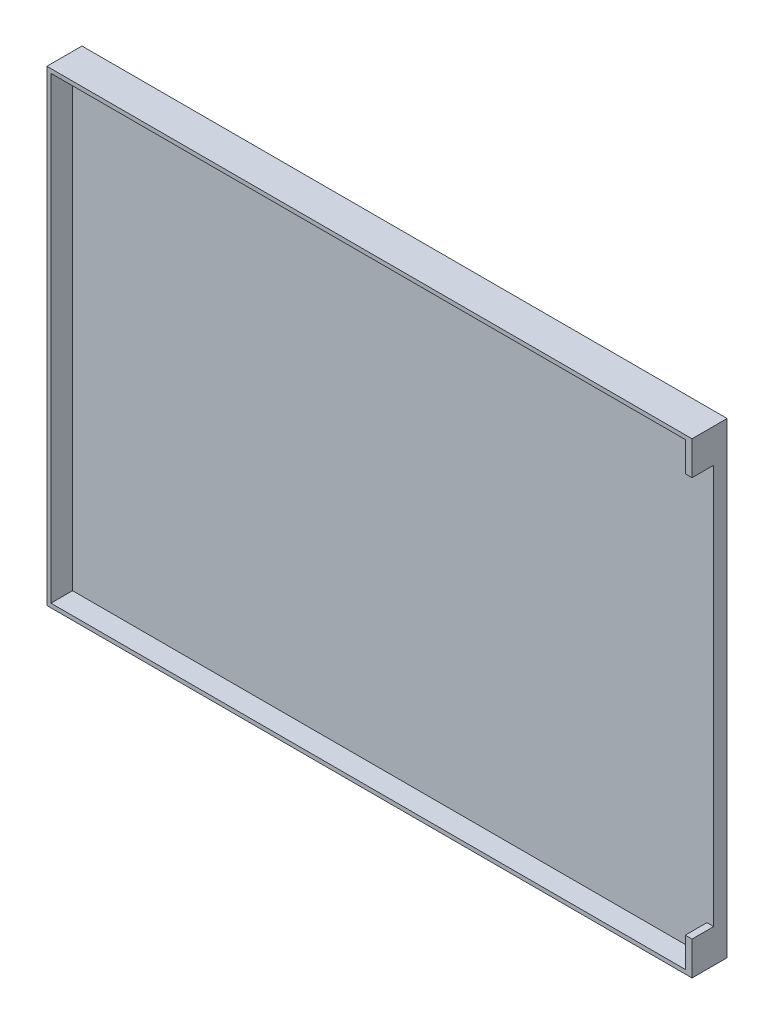
from build123d import *

# Parameters (mm, degrees)
SKETCH_1_W      = 47.8
SKETCH_1_H      = 34.6
EXTRUDE_1_DEPTH = 1
EXTRUDE_2_DEPTH = 1.6


with BuildPart() as part:
    # Эскиз1 → Бобышка-Вытянуть1 (new body)
    with BuildSketch(Plane.XY):
        Rectangle(SKETCH_1_W, SKETCH_1_H)
    extrude(amount=EXTRUDE_1_DEPTH)

    # Эскиз2 → Бобышка-Вытянуть2 (add)
    with BuildSketch(Plane.XY.offset(1)):
        Polygon((23.9, 17.3), (-23.9, 17.3), (-23.9, -17.3), (23.9, -17.3), (23.9, -14.8), (23.4, -14.8), (23.4, -17), (-23.6, -17), (-23.6, 17), (23.4, 17), (23.4, 14.8), (23.9, 14.8), align=None)
    extrude(amount=EXTRUDE_2_DEPTH)


solid = part.part
